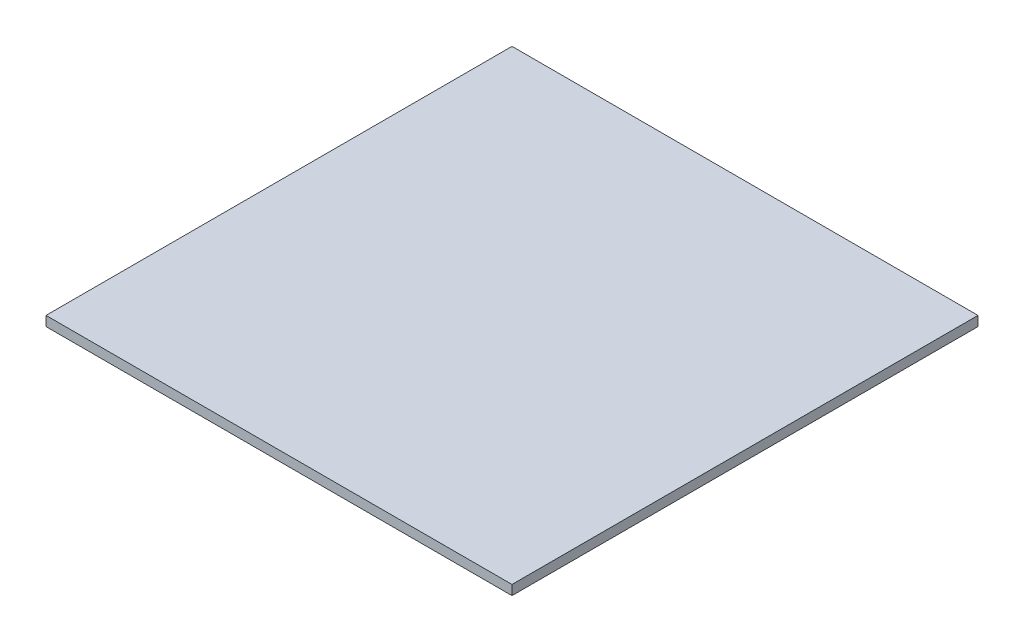
from build123d import *

# Parameters (mm, degrees)
SKETCH1_W           = 152.4
SKETCH1_H           = 152.4
BOSS_EXTRUDE1_DEPTH = 3.175


with BuildPart() as part:
    # Sketch1 → Boss-Extrude1 (new body)
    with BuildSketch(Plane(origin=(0, 0, 0), x_dir=(1, 0, 0), z_dir=(0, 1, 0))):
        with Locations((76.2, 76.2)):
            Rectangle(SKETCH1_W, SKETCH1_H)
    extrude(amount=BOSS_EXTRUDE1_DEPTH)


solid = part.part
